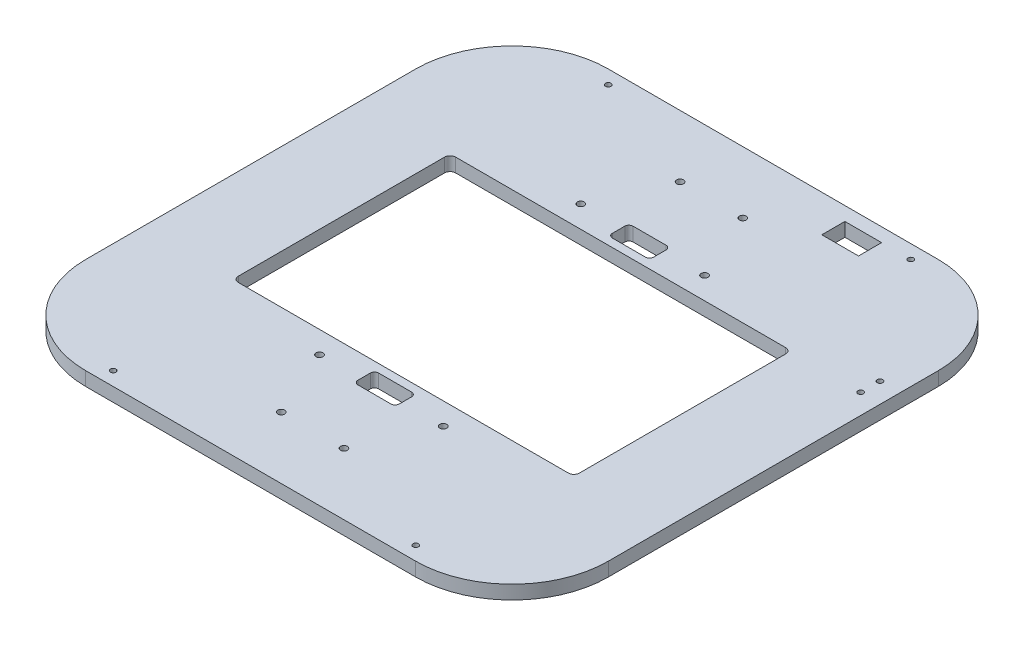
from build123d import *

# Parameters (mm, degrees)
ESBO_O1_W                = 190
ESBO_O1_H                = 190
RESSALTO_EXTRUS_O1_DEPTH = 5
FILETE1_R                = 35
ESBO_O2_R                = 1
CORTE_EXTRUS_O1_DEPTH    = 135.443296597
CORTE_EXTRUS_O2_DEPTH    = 10
SKETCH3_R                = 1.25
CUT_EXTRUDE1_DEPTH       = 135.443296597
SKETCH5_R                = 1
CUT_EXTRUDE3_DEPTH       = 135.443296597
SKETCH7_W                = 13.35
SKETCH7_H                = 8.4
CUT_EXTRUDE5_DEPTH       = 135.443296597
CUT_EXTRUDE6_DEPTH       = 135.443296597


with BuildPart() as part:
    # Esboço1 → Ressalto-extrusão1 (new body)
    with BuildSketch(Plane(origin=(0, 0, 0), x_dir=(1, 0, 0), z_dir=(0, 1, 0))):
        Rectangle(ESBO_O1_W, ESBO_O1_H)
    extrude(amount=RESSALTO_EXTRUS_O1_DEPTH)

    # Filete1
    filete1_edges = [part.edges().sort_by_distance(p)[0] for p in [
        (95, 2.5, 95),
        (-95, 2.5, 95),
        (-95, 2.5, -95),
        (95, 2.5, -95),
    ]]
    fillet(filete1_edges, radius=FILETE1_R)

    # Esboço2 → Corte-extrusão1 (cut, through all)
    with BuildSketch(Plane(origin=(0, 5, 0), x_dir=(1, 0, 0), z_dir=(0, 1, 0))):
        with Locations(Location((-55, 90, 0), (0, 0, 270))):
            Circle(ESBO_O2_R)
        with Locations(Location((55, 90, 0), (0, 0, 90))):
            Circle(ESBO_O2_R)
        with Locations(Location((55, -90, 0), (0, 0, 270))):
            Circle(ESBO_O2_R)
        with Locations(Location((-55, -90, 0), (0, 0, 90))):
            Circle(ESBO_O2_R)
    extrude(amount=-CORTE_EXTRUS_O1_DEPTH, mode=Mode.SUBTRACT)

    # Esboço3 → Corte-extrusão2 (cut)
    with BuildSketch(Plane(origin=(0, 5, 0), x_dir=(1, 0, 0), z_dir=(0, 1, 0))):
        with BuildLine():
            Line((-60, 39.5), (60, 39.5))
            ThreePointArc((60, 39.5), (61.414213562, 38.914213562), (62, 37.5))
            Line((62, 37.5), (62, -37.5))
            ThreePointArc((62, -37.5), (61.414213562, -38.914213562), (60, -39.5))
            Line((60, -39.5), (-60, -39.5))
            ThreePointArc((-60, -39.5), (-61.414213562, -38.914213562), (-62, -37.5))
            Line((-62, -37.5), (-62, 37.5))
            ThreePointArc((-62, 37.5), (-61.414213562, 38.914213562), (-60, 39.5))
        make_face()
    extrude(amount=-CORTE_EXTRUS_O2_DEPTH, mode=Mode.SUBTRACT)

    # Sketch3 → Cut-Extrude1 (cut, through all)
    with BuildSketch(Plane(origin=(0, 5, 0), x_dir=(1, 0, 0), z_dir=(0, 1, 0))):
        with Locations(Location((22.50310845, 47.5, 0), (0, 0, 270))):
            Circle(SKETCH3_R)
        with Locations(Location((-22.49689155, 47.5, 0), (0, 0, 270))):
            Circle(SKETCH3_R)
        with Locations(Location((-11.39689155, 72.5, 0), (0, 0, 270))):
            Circle(SKETCH3_R)
        with Locations(Location((11.40310845, 72.5, 0), (0, 0, 270))):
            Circle(SKETCH3_R)
        with Locations(Location((11.40310845, -72.5, 0), (0, 0, 90))):
            Circle(SKETCH3_R)
        with Locations(Location((-11.39689155, -72.5, 0), (0, 0, 90))):
            Circle(SKETCH3_R)
        with Locations(Location((-22.49689155, -47.5, 0), (0, 0, 90))):
            Circle(SKETCH3_R)
        with Locations(Location((22.50310845, -47.5, 0), (0, 0, 90))):
            Circle(SKETCH3_R)
    extrude(amount=-CUT_EXTRUDE1_DEPTH, mode=Mode.SUBTRACT)

    # Sketch5 → Cut-Extrude3 (cut, through all)
    with BuildSketch(Plane(origin=(0, 5, 0), x_dir=(1, 0, 0), z_dir=(0, 1, 0))):
        with Locations(Location((87.705642178, 46.088474581, 0), (0, 0, 270))):
            Circle(SKETCH5_R)
        with Locations(Location((87.705642178, 39.070544877, 0), (0, 0, 270))):
            Circle(SKETCH5_R)
    extrude(amount=-CUT_EXTRUDE3_DEPTH, mode=Mode.SUBTRACT)

    # Sketch7 → Cut-Extrude5 (cut, through all)
    with BuildSketch(Plane(origin=(0, 5, 0), x_dir=(1, 0, 0), z_dir=(0, 1, 0))):
        with Locations((37.711300079, 85.8)):
            Rectangle(SKETCH7_W, SKETCH7_H)
    extrude(amount=-CUT_EXTRUDE5_DEPTH, mode=Mode.SUBTRACT)

    # Sketch8 → Cut-Extrude6 (cut, through all)
    with BuildSketch(Plane(origin=(0, 5, 0), x_dir=(1, 0, 0), z_dir=(0, 1, 0))):
        with BuildLine():
            Line((6.00310845, -50), (-5.99689155, -50))
            ThreePointArc((-5.99689155, -50), (-7.057551722, -49.560660172), (-7.49689155, -48.5))
            Line((-7.49689155, -48.5), (-7.49689155, -44))
            ThreePointArc((-7.49689155, -44), (-7.057551722, -42.939339828), (-5.99689155, -42.5))
            Line((-5.99689155, -42.5), (6.00310845, -42.5))
            ThreePointArc((6.00310845, -42.5), (7.063768622, -42.939339828), (7.50310845, -44))
            Line((7.50310845, -44), (7.50310845, -48.5))
            ThreePointArc((7.50310845, -48.5), (7.063768622, -49.560660172), (6.00310845, -50))
        make_face()
        with BuildLine():
            Line((-7.49689155, 48.5), (-7.49689155, 44))
            ThreePointArc((-7.49689155, 44), (-7.057551722, 42.939339828), (-5.99689155, 42.5))
            Line((-5.99689155, 42.5), (6.00310845, 42.5))
            ThreePointArc((6.00310845, 42.5), (7.063768622, 42.939339828), (7.50310845, 44))
            Line((7.50310845, 44), (7.50310845, 48.5))
            ThreePointArc((7.50310845, 48.5), (7.063768622, 49.560660172), (6.00310845, 50))
            Line((6.00310845, 50), (-5.99689155, 50))
            ThreePointArc((-5.99689155, 50), (-7.057551722, 49.560660172), (-7.49689155, 48.5))
        make_face()
    extrude(amount=-CUT_EXTRUDE6_DEPTH, mode=Mode.SUBTRACT)


solid = part.part
